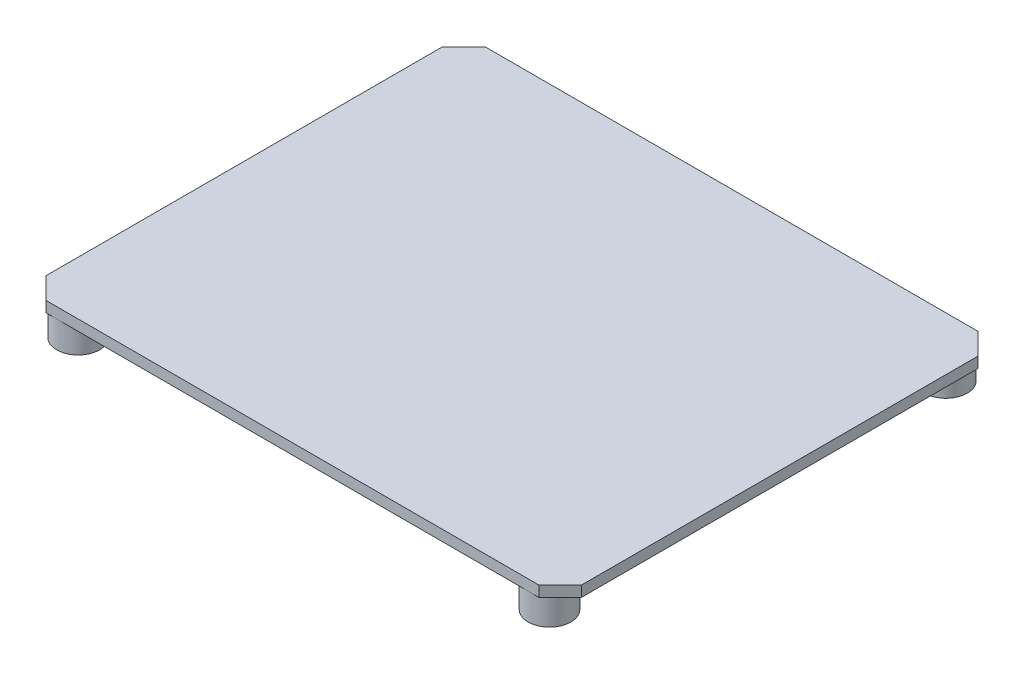
from build123d import *

# Parameters (mm, degrees)
SHADE_PLATE_DEPTH = 2
SKETCH2_R         = 4
POSTS_DEPTH       = 5.1
SKETCH3_R         = 1.25
POST_PILOTS_DEPTH = 6.5


with BuildPart() as part:
    # Sketch1 → Shade Plate (new body)
    with BuildSketch(Plane(origin=(0, 35.4, 0), x_dir=(1, 0, 0), z_dir=(0, 1, 0))):
        Polygon((-46, -102), (46, -102), (50, -98), (50, -24), (46, -20), (-46, -20), (-50, -24), (-50, -98), align=None)
    extrude(amount=SHADE_PLATE_DEPTH)

    # Sketch2 → Posts (add)
    with BuildSketch(Plane(origin=(0, 30.4, 0), x_dir=(1, 0, 0), z_dir=(0, 1, 0))):
        with Locations(Location((-44, -24, 0), (0, 0, 90))):
            Circle(SKETCH2_R)
        with Locations(Location((-44, -98, 0), (0, 0, 270))):
            Circle(SKETCH2_R)
        with Locations(Location((44, -24, 0), (0, 0, 90))):
            Circle(SKETCH2_R)
        with Locations(Location((44, -98, 0), (0, 0, 270))):
            Circle(SKETCH2_R)
    extrude(amount=POSTS_DEPTH)

    # Sketch3 → Post Pilots (cut)
    with BuildSketch(Plane(origin=(0, 29.9, 0), x_dir=(1, 0, 0), z_dir=(0, 1, 0))):
        with Locations(Location((-44, -24, 0), (0, 0, 270))):
            Circle(SKETCH3_R)
        with Locations(Location((-44, -98, 0), (0, 0, 270))):
            Circle(SKETCH3_R)
        with Locations(Location((44, -24, 0), (0, 0, 270))):
            Circle(SKETCH3_R)
        with Locations(Location((44, -98, 0), (0, 0, 270))):
            Circle(SKETCH3_R)
    extrude(amount=POST_PILOTS_DEPTH, mode=Mode.SUBTRACT)


solid = part.part
